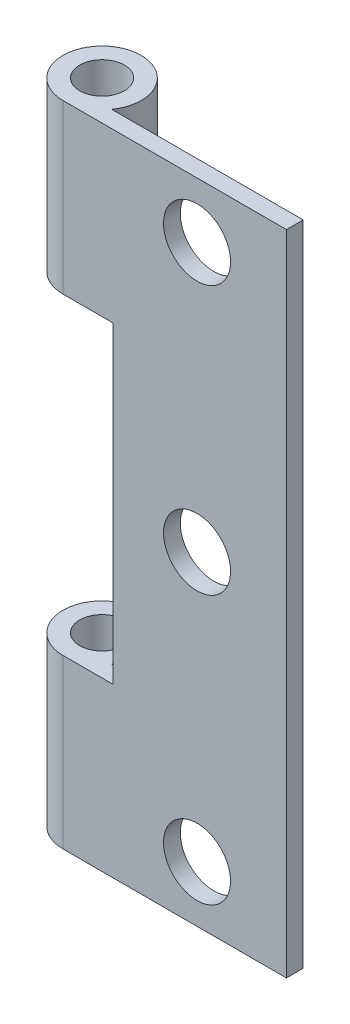
from build123d import *

# Parameters (mm, degrees)
SKETCH1_W                      = 15.875
SKETCH1_H                      = 46.0375
BOSS_EXTRUDE1_DEPTH            = 0.5953125
SKETCH2_R                      = 2.778125
SKETCH2_R_2                    = 1.5875
BOSS_EXTRUDE2_DEPTH            = 23.01875
CUT_EXTRUDE1_DEPTH             = 26.870801526
CUT_EXTRUDE1_DEPTH_BACK        = 26.870801526
SKETCH3_W                      = 6.35
SKETCH3_H                      = 22.225
F_3_16_0_1875_DIAMETER_HOLE1_D = 4.7625


with BuildPart() as part:
    # Sketch1 → Boss-Extrude1 (new, symmetric)
    with BuildSketch(Plane.XY):
        Rectangle(SKETCH1_W, SKETCH1_H)
    extrude(amount=BOSS_EXTRUDE1_DEPTH, both=True)

    # Sketch2 → Boss-Extrude2 (add, symmetric)
    with BuildSketch(Plane(origin=(0, 0, 0), x_dir=(1, 0, 0), z_dir=(0, 1, 0))):
        with Locations((-7.9375, 2.1828125)):
            Circle(SKETCH2_R)
        with Locations(Location((-7.9375, 2.1828125, 0), (0, 0, 270))):
            Circle(SKETCH2_R_2, mode=Mode.SUBTRACT)
    extrude(amount=BOSS_EXTRUDE2_DEPTH, both=True)

    # Sketch3 → Cut-Extrude1 (cut, two sides: drawn at the far end of the back side and taken through both)
    with BuildSketch(Plane.XY.offset(-CUT_EXTRUDE1_DEPTH_BACK)):
        with Locations((-7.540625, 0)):
            Rectangle(SKETCH3_W, SKETCH3_H)
    extrude(amount=CUT_EXTRUDE1_DEPTH + CUT_EXTRUDE1_DEPTH_BACK, mode=Mode.SUBTRACT)

    # 3/16 (0.1875) Diameter Hole1 (through all)
    with Locations(Plane(origin=(0, 0, -0.5953125), x_dir=(-1, 0, 0), z_dir=(0, 0, -1))):
        with Locations((-1.5875, -19.05), (-1.5875, 0), (-1.5875, 19.05)):
            Hole(F_3_16_0_1875_DIAMETER_HOLE1_D / 2)


solid = part.part
